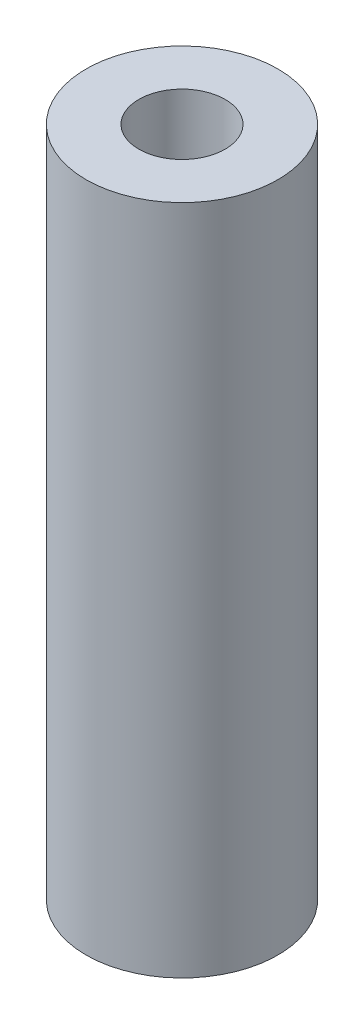
from build123d import *

# Parameters (mm, degrees)
CROQUIS1_R                   = 5
SALIENTE_EXTRUIR1_DEPTH      = 17.5
TALADRO_DE_MARGEN_PARA_M41_D = 4.5


with BuildPart() as part:
    # Croquis1 → Saliente-Extruir1 (new, symmetric)
    with BuildSketch(Plane(origin=(0, 0, 0), x_dir=(1, 0, 0), z_dir=(0, 1, 0))):
        with Locations(Location((0, 0, 0), (0, 0, 270))):
            Circle(CROQUIS1_R)
    extrude(amount=SALIENTE_EXTRUIR1_DEPTH, both=True)

    # Taladro de margen para M41 (through all)
    with Locations(Plane(origin=(0, 17.5, 0), x_dir=(1, 0, 0), z_dir=(0, 1, 0))):
        with Locations((0, 0)):
            Hole(TALADRO_DE_MARGEN_PARA_M41_D / 2)


solid = part.part
